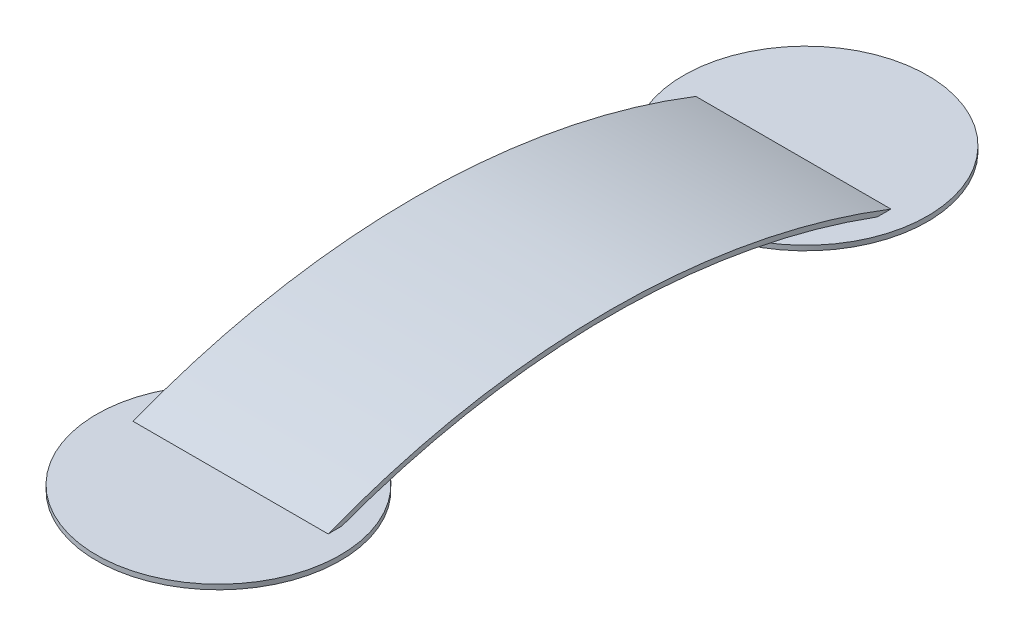
from build123d import *

# Parameters (mm, degrees)
BOSS_EXTRUDE1_DEPTH = 8
SKETCH2_R           = 5
BOSS_EXTRUDE2_DEPTH = 0.2


with BuildPart() as part:
    # Sketch1 → Boss-Extrude1 (new body)
    with BuildSketch(Plane(origin=(0, 0, 0), x_dir=(0, 0, -1), z_dir=(1, 0, 0))):
        with BuildLine():
            Line((-11.5, 0), (-12.037045295, 0))
            ThreePointArc((-12.037045295, 0), (0, 2.374158249), (12.037045295, 0))
            Line((12.037045295, 0), (11.5, 0))
            ThreePointArc((11.5, 0), (0, 2.174158249), (-11.5, 0))
        make_face()
    extrude(amount=BOSS_EXTRUDE1_DEPTH)

    # Sketch2 → Boss-Extrude2 (add)
    with BuildSketch(Plane(origin=(0, 0, 0), x_dir=(1, 0, 0), z_dir=(0, 1, 0))):
        with Locations(Location((4, 12.037045295, 0), (0, 0, 270))):
            Circle(SKETCH2_R)
        with Locations(Location((4, -12.037045295, 0), (0, 0, 90))):
            Circle(SKETCH2_R)
    extrude(amount=BOSS_EXTRUDE2_DEPTH)


solid = part.part
